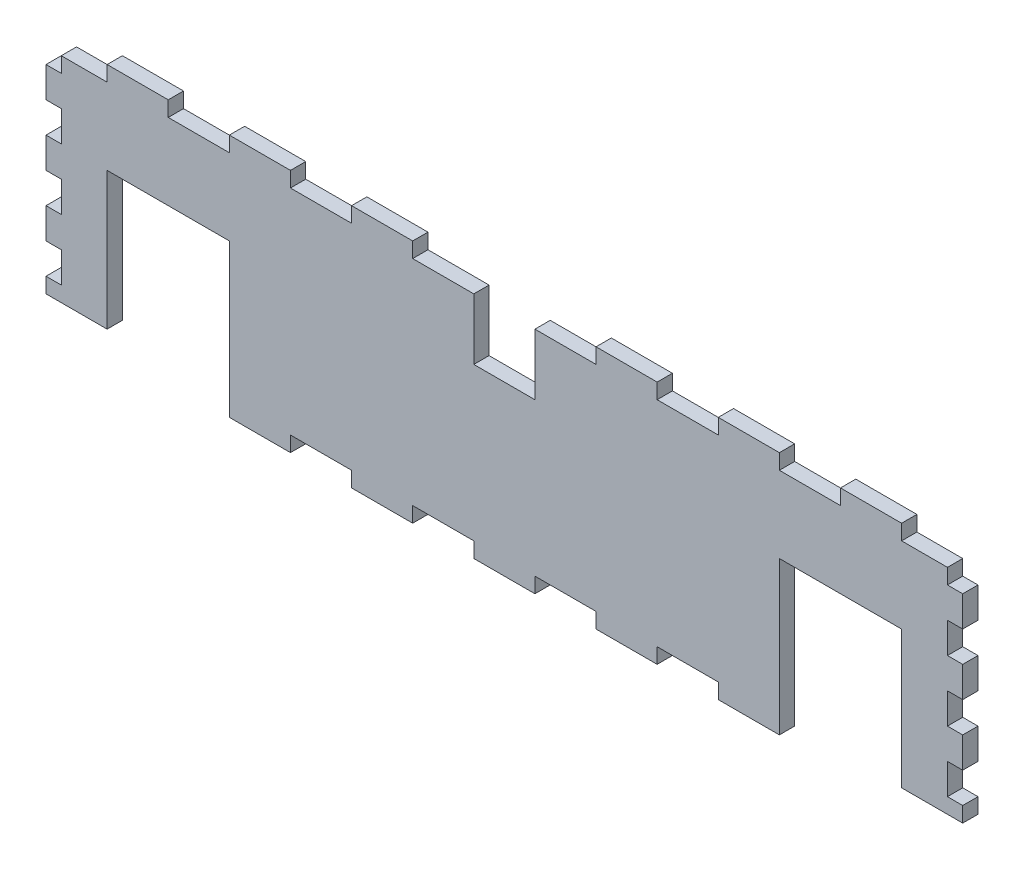
from build123d import *

# Parameters (mm, degrees)
SKETCH1_W           = 381
SKETCH1_H           = 101.6
BOSS_EXTRUDE1_DEPTH = 6.35
SKETCH2_W           = 19.05
SKETCH2_H           = 6.35
SKETCH2_W_2         = 6.35
SKETCH2_H_2         = 12.7
SKETCH2_W_3         = 25.4
CUT_EXTRUDE1_DEPTH  = 6.35
SKETCH3_W           = 50.8
SKETCH3_H           = 63.5
CUT_EXTRUDE2_DEPTH  = 6.35
SKETCH4_W           = 25.4
SKETCH4_H           = 31.75
CUT_EXTRUDE3_DEPTH  = 6.35


with BuildPart() as part:
    # Sketch1 → Boss-Extrude1 (new body)
    with BuildSketch(Plane.XY):
        Rectangle(SKETCH1_W, SKETCH1_H)
    extrude(amount=BOSS_EXTRUDE1_DEPTH)

    # Sketch2 → Cut-Extrude1 (cut)
    with BuildSketch(Plane.XY.offset(6.35)):
        with Locations((-174.625, 47.625)):
            Rectangle(SKETCH2_W, SKETCH2_H)
        with Locations((-187.325, 47.625)):
            Rectangle(SKETCH2_W_2, SKETCH2_H)
        with Locations((-187.325, 41.275)):
            Rectangle(SKETCH2_W_2, SKETCH2_H)
        with Locations((-187.325, 19.05)):
            Rectangle(SKETCH2_W_2, SKETCH2_H_2)
        with Locations((-187.325, -6.35)):
            Rectangle(SKETCH2_W_2, SKETCH2_H_2)
        with Locations((-187.325, -31.75)):
            Rectangle(SKETCH2_W_2, SKETCH2_H_2)
        with Locations((-177.8, -47.625)):
            Rectangle(SKETCH2_W_3, SKETCH2_H)
        with Locations((-127, -47.625)):
            Rectangle(SKETCH2_W_3, SKETCH2_H)
        with Locations((-76.2, -47.625)):
            Rectangle(SKETCH2_W_3, SKETCH2_H)
        with Locations((-25.4, -47.625)):
            Rectangle(SKETCH2_W_3, SKETCH2_H)
        with Locations((25.4, -47.625)):
            Rectangle(SKETCH2_W_3, SKETCH2_H)
        with Locations((-127, 47.625)):
            Rectangle(SKETCH2_W_3, SKETCH2_H)
        with Locations((-76.2, 47.625)):
            Rectangle(SKETCH2_W_3, SKETCH2_H)
        with Locations((-25.4, 47.625)):
            Rectangle(SKETCH2_W_3, SKETCH2_H)
        with Locations((25.4, 47.625)):
            Rectangle(SKETCH2_W_3, SKETCH2_H)
        with Locations((76.2, 47.625)):
            Rectangle(SKETCH2_W_3, SKETCH2_H)
        with Locations((76.2, -47.625)):
            Rectangle(SKETCH2_W_3, SKETCH2_H)
        with Locations((127, -47.625)):
            Rectangle(SKETCH2_W_3, SKETCH2_H)
        with Locations((127, 47.625)):
            Rectangle(SKETCH2_W_3, SKETCH2_H)
        with Locations((174.625, 47.625)):
            Rectangle(SKETCH2_W, SKETCH2_H)
        with Locations((187.325, 47.625)):
            Rectangle(SKETCH2_W_2, SKETCH2_H)
        with Locations((187.325, 41.275)):
            Rectangle(SKETCH2_W_2, SKETCH2_H)
        with Locations((187.325, 19.05)):
            Rectangle(SKETCH2_W_2, SKETCH2_H_2)
        with Locations((187.325, -6.35)):
            Rectangle(SKETCH2_W_2, SKETCH2_H_2)
        with Locations((187.325, -31.75)):
            Rectangle(SKETCH2_W_2, SKETCH2_H_2)
        with Locations((177.8, -47.625)):
            Rectangle(SKETCH2_W_3, SKETCH2_H)
    extrude(amount=-CUT_EXTRUDE1_DEPTH, mode=Mode.SUBTRACT)

    # Sketch3 → Cut-Extrude2 (cut)
    with BuildSketch(Plane.XY.offset(6.35)):
        with Locations((-139.7, -19.05)):
            Rectangle(SKETCH3_W, SKETCH3_H)
        with Locations((139.7, -19.05)):
            Rectangle(SKETCH3_W, SKETCH3_H)
    extrude(amount=-CUT_EXTRUDE2_DEPTH, mode=Mode.SUBTRACT)

    # Sketch4 → Cut-Extrude3 (cut)
    with BuildSketch(Plane.XY.offset(6.35)):
        with Locations((0, 34.925)):
            Rectangle(SKETCH4_W, SKETCH4_H)
    extrude(amount=-CUT_EXTRUDE3_DEPTH, mode=Mode.SUBTRACT)


solid = part.part
